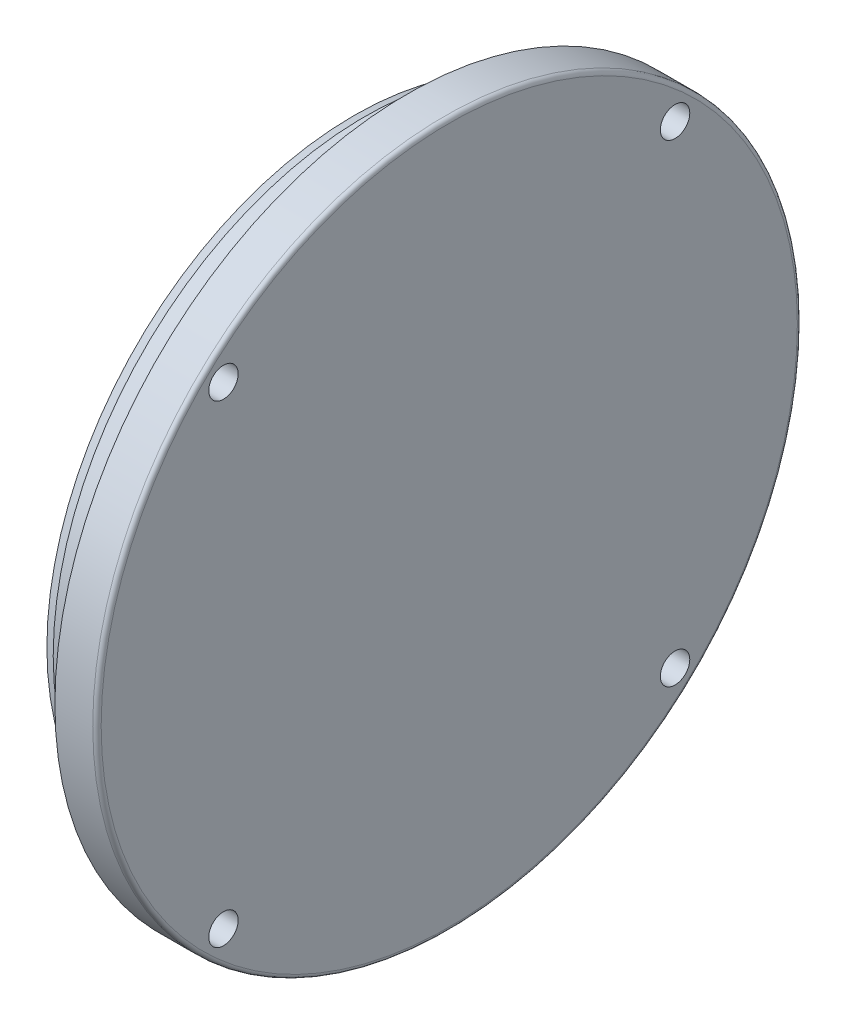
from build123d import *

# Parameters (mm, degrees)
IZIM2_R               = 4
KES_EKSTR_ZYON1_DEPTH = 20
IZIM3_R               = 7
KES_EKSTR_ZYON2_DEPTH = 10
RADYUS1_R             = 2


with BuildPart() as part:
    # Çizim1 → Döndür1 (revolve)
    with BuildSketch(Plane.XY, mode=Mode.PRIVATE) as d_nd_r1_sk:
        Polygon((0, 31), (5, 31), (5, 32.75), (7.3, 32.75), (7.3, 31), (25.3, 31), (25.3, 16), (35.3, 16), (35.3, 0), (45.3, 0), (45.3, 161), (45.3, 167.5), (25.3, 167.5), (25.3, 148), (5, 148), (0, 146), align=None)
    revolve(d_nd_r1_sk.sketch.rotate(Axis((0, 0, 0), (1, 0, 0)), 90), axis=Axis((0, 0, 0), (1, 0, 0)))

    # Çizim2 → Kes-Ekstrüzyon1 (cut)
    with BuildSketch(Plane(origin=(45.3, 0, 0), x_dir=(0, 0, -1), z_dir=(1, 0, 0))):
        with Locations((-107.349895203, 112.5)):
            Circle(IZIM2_R)
        with Locations((107.349895203, 112.5)):
            Circle(IZIM2_R)
        with Locations((107.349895203, -112.5)):
            Circle(IZIM2_R)
        with Locations((-107.349895203, -112.5)):
            Circle(IZIM2_R)
    extrude(amount=-KES_EKSTR_ZYON1_DEPTH, mode=Mode.SUBTRACT)

    # Çizim3 → Kes-Ekstrüzyon2 (cut)
    with BuildSketch(Plane(origin=(45.3, 0, 0), x_dir=(0, 0, -1), z_dir=(1, 0, 0))):
        with Locations((-107.349895203, 112.5)):
            Circle(IZIM3_R)
        with Locations((107.349895203, 112.5)):
            Circle(IZIM3_R)
        with Locations((107.349895203, -112.5)):
            Circle(IZIM3_R)
        with Locations((-107.349895203, -112.5)):
            Circle(IZIM3_R)
    extrude(amount=-KES_EKSTR_ZYON2_DEPTH, mode=Mode.SUBTRACT)

    # Radyus1
    radyus1_edges = [part.edges().sort_by_distance(p)[0] for p in [
        (45.3, 0, -167.5),
    ]]
    fillet(radyus1_edges, radius=RADYUS1_R)


solid = part.part
